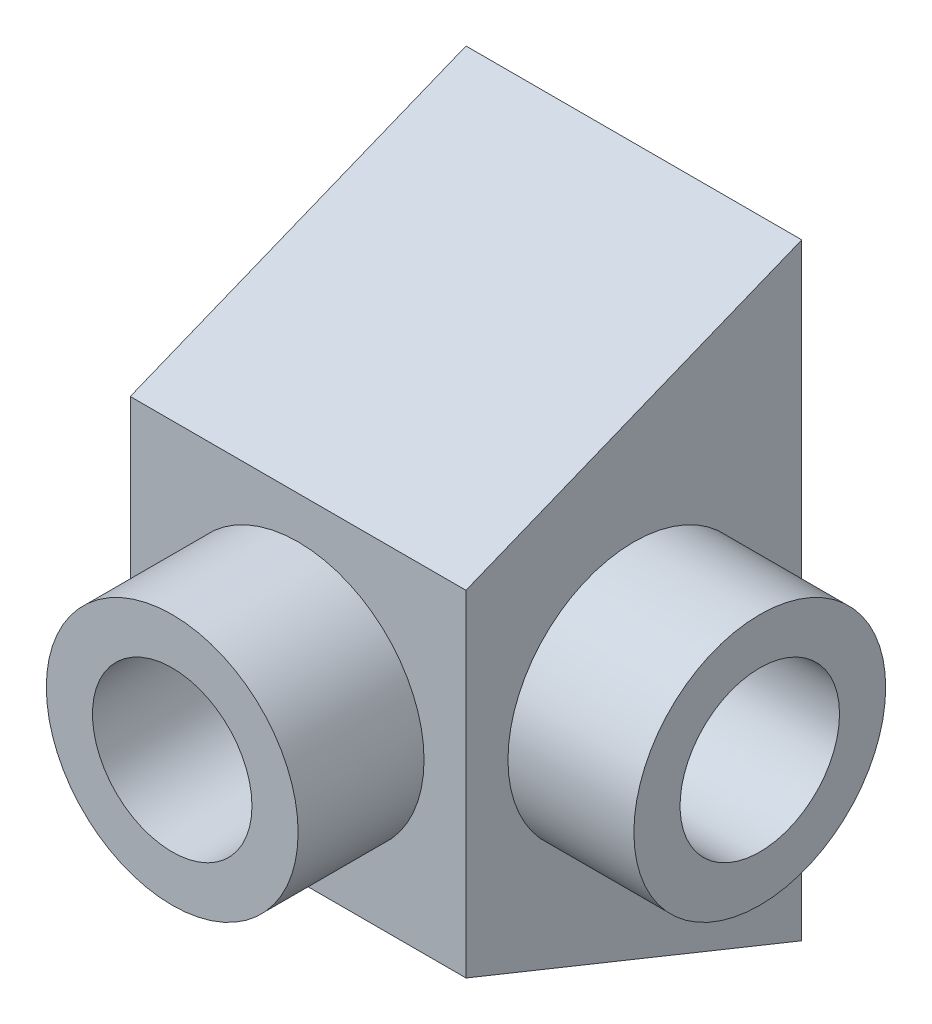
from build123d import *

# Parameters (mm, degrees)
CROQUIS1_R              = 30
CROQUIS1_R_2            = 19
SALIENTE_EXTRUIR1_DEPTH = 30
CROQUIS2_W              = 80
CROQUIS2_H              = 80
SALIENTE_EXTRUIR2_DEPTH = 80
CROQUIS3_R              = 30
CROQUIS3_R_2            = 19
SALIENTE_EXTRUIR3_DEPTH = 30
SALIENTE_EXTRUIR4_DEPTH = 80


with BuildPart() as part:
    # Croquis1 → Saliente-Extruir1 (new body)
    with BuildSketch(Plane.XY):
        Circle(CROQUIS1_R)
        Circle(CROQUIS1_R_2, mode=Mode.SUBTRACT)
    extrude(amount=SALIENTE_EXTRUIR1_DEPTH)

    # Croquis2 → Saliente-Extruir2 (add)
    with BuildSketch(Plane.XY):
        Rectangle(CROQUIS2_W, CROQUIS2_H)
    extrude(amount=-SALIENTE_EXTRUIR2_DEPTH)

    # Croquis3 → Saliente-Extruir3 (add)
    with BuildSketch(Plane(origin=(40, 0, 0), x_dir=(0, 0, -1), z_dir=(1, 0, 0))):
        with Locations((40, 0)):
            Circle(CROQUIS3_R)
        with Locations(Location((40, 0, 0), (0, 0, 90))):
            Circle(CROQUIS3_R_2, mode=Mode.SUBTRACT)
    extrude(amount=SALIENTE_EXTRUIR3_DEPTH)

    # Croquis4 → Saliente-Extruir4 (add)
    with BuildSketch(Plane(origin=(-40, 0, 0), x_dir=(0, 0, -1), z_dir=(1, 0, 0))):
        Polygon((80, 40), (80, 72.32), (0, 40), align=None)
        Polygon((0, -40), (80, -40), (80, -72.32), align=None)
    extrude(amount=SALIENTE_EXTRUIR4_DEPTH)


solid = part.part
